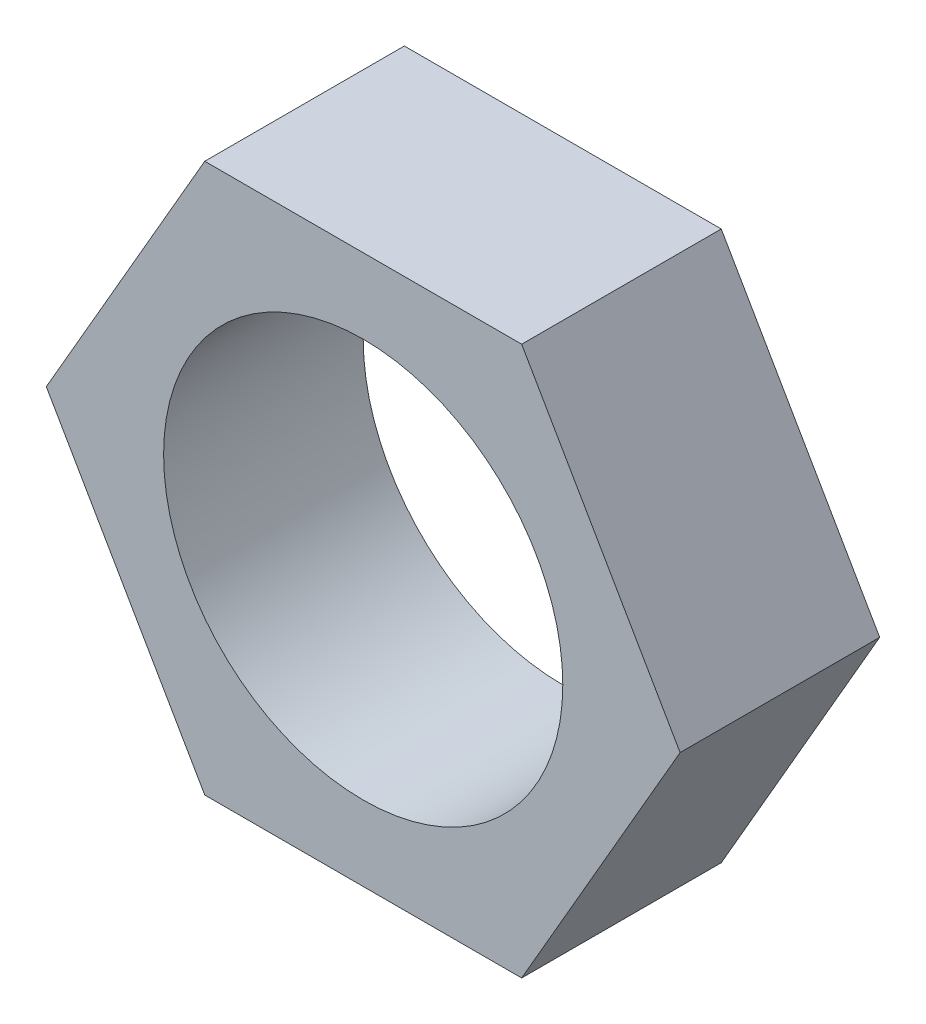
from build123d import *

# Parameters (mm, degrees)
BOSS_EXTRUDE1_DEPTH = 5.08
CUT_EXTRUDE1_REACH  = 13.817
SKETCH2_R           = 5.08


with BuildPart() as part:
    # Sketch1 → Boss-Extrude1 (new body)
    with BuildSketch(Plane.XY):
        Polygon((8.065583261, 0), (4.03279163, 6.985), (-4.03279163, 6.985), (-8.065583261, 0), (-4.03279163, -6.985), (4.03279163, -6.985), align=None)
    extrude(amount=BOSS_EXTRUDE1_DEPTH)

    # Sketch2 → Cut-Extrude1 (cut, up to next)
    with BuildSketch(Plane.XY.offset(5.08), mode=Mode.PRIVATE) as cut_extrude1_sk1:
        Circle(SKETCH2_R)
    cut_extrude1_tool1 = extrude(cut_extrude1_sk1.sketch, amount=-CUT_EXTRUDE1_REACH, mode=Mode.PRIVATE) & part.part
    add(cut_extrude1_tool1.solids().sort_by_distance((0, 0, 5.08))[0], mode=Mode.SUBTRACT)


solid = part.part
